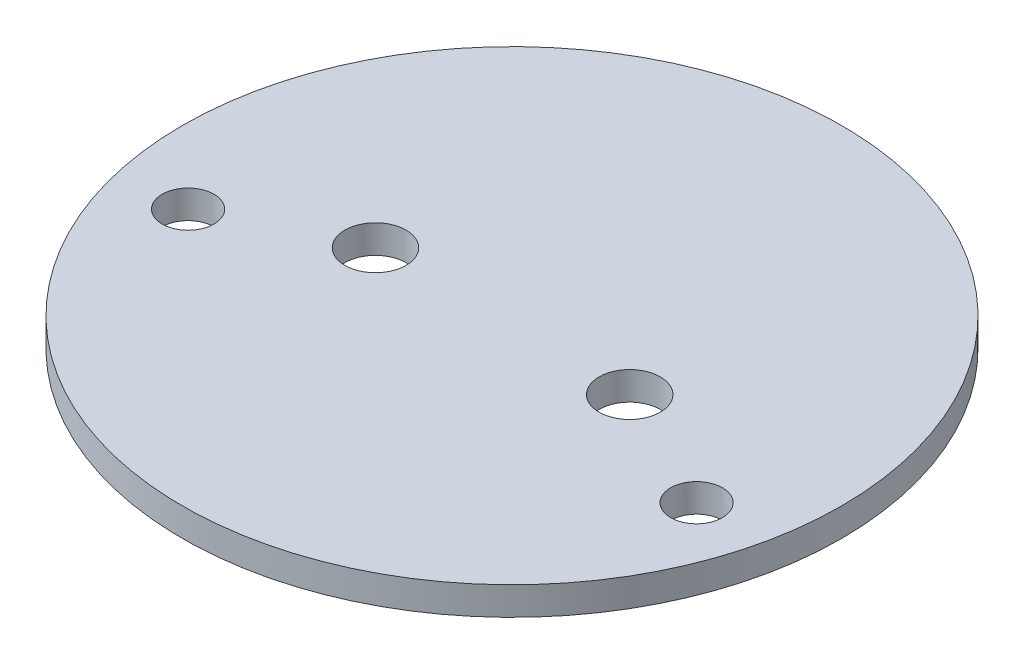
from build123d import *

# Parameters (mm, degrees)
SKETCH2_W          = 35
SKETCH2_H          = 3
CUT_EXTRUDE1_REACH = 51.588
SKETCH3_R          = 3.25
CUT_EXTRUDE2_REACH = 51.588
SKETCH4_R          = 2.75


with BuildPart() as part:
    # Sketch2 → Revolve1 (revolve)
    with BuildSketch(Plane.XY):
        with Locations((17.5, 1.5)):
            Rectangle(SKETCH2_W, SKETCH2_H)
    revolve(axis=Axis((0, -417.112175525, 0), (0, 1, 0)))

    # Sketch3 → Cut-Extrude1 (cut, up to next)
    with BuildSketch(Plane(origin=(0, 3, 0), x_dir=(1, 0, 0), z_dir=(0, 1, 0)), mode=Mode.PRIVATE) as cut_extrude1_sk1:
        with Locations(Location((-13.5, -1, 0), (0, 0, 180))):
            Circle(SKETCH3_R)
    cut_extrude1_tool1 = extrude(cut_extrude1_sk1.sketch, amount=-CUT_EXTRUDE1_REACH, mode=Mode.PRIVATE) & part.part
    # Sketch3 → Cut-Extrude1 (cut, up to next)
    with BuildSketch(Plane(origin=(0, 3, 0), x_dir=(1, 0, 0), z_dir=(0, 1, 0)), mode=Mode.PRIVATE) as cut_extrude1_sk2:
        with Locations(Location((13.5, -1, 0), (0, 0, 180))):
            Circle(SKETCH3_R)
    cut_extrude1_tool2 = extrude(cut_extrude1_sk2.sketch, amount=-CUT_EXTRUDE1_REACH, mode=Mode.PRIVATE) & part.part
    add(cut_extrude1_tool1.solids().sort_by_distance((-13.5, 3, 1))[0], mode=Mode.SUBTRACT)
    add(cut_extrude1_tool2.solids().sort_by_distance((13.5, 3, 1))[0], mode=Mode.SUBTRACT)

    # Sketch4 → Cut-Extrude2 (cut, up to next)
    with BuildSketch(Plane(origin=(0, 3, 0), x_dir=(1, 0, 0), z_dir=(0, 1, 0)), mode=Mode.PRIVATE) as cut_extrude2_sk1:
        with Locations(Location((-27, -7.4, 0), (0, 0, 180))):
            Circle(SKETCH4_R)
    cut_extrude2_tool1 = extrude(cut_extrude2_sk1.sketch, amount=-CUT_EXTRUDE2_REACH, mode=Mode.PRIVATE) & part.part
    # Sketch4 → Cut-Extrude2 (cut, up to next)
    with BuildSketch(Plane(origin=(0, 3, 0), x_dir=(1, 0, 0), z_dir=(0, 1, 0)), mode=Mode.PRIVATE) as cut_extrude2_sk2:
        with Locations(Location((27, -7.4, 0), (0, 0, 180))):
            Circle(SKETCH4_R)
    cut_extrude2_tool2 = extrude(cut_extrude2_sk2.sketch, amount=-CUT_EXTRUDE2_REACH, mode=Mode.PRIVATE) & part.part
    add(cut_extrude2_tool1.solids().sort_by_distance((-27, 3, 7.4))[0], mode=Mode.SUBTRACT)
    add(cut_extrude2_tool2.solids().sort_by_distance((27, 3, 7.4))[0], mode=Mode.SUBTRACT)


solid = part.part
